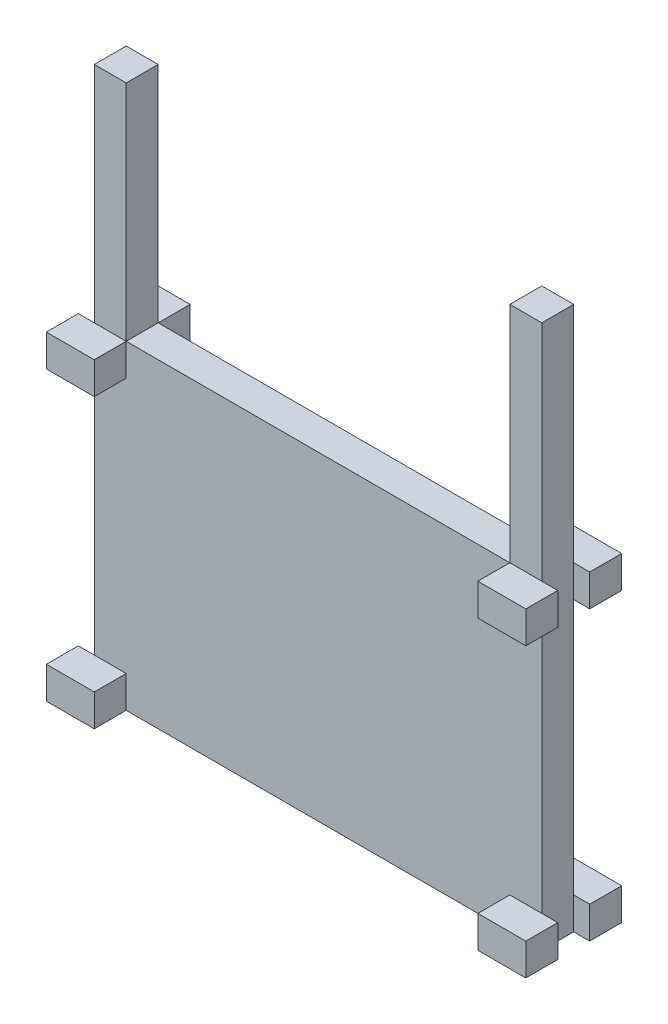
from build123d import *

# Parameters (mm, degrees)
SKETCH1_W           = 35.56
SKETCH1_H           = 25.4
BOSS_EXTRUDE1_DEPTH = 2.54
SKETCH2_W           = 2.54
SKETCH2_H           = 2.54
BOSS_EXTRUDE2_DEPTH = 2.54
SKETCH4_W           = 2.54
SKETCH4_H           = 2.54
BOSS_EXTRUDE4_DEPTH = 1.27
SKETCH5_W           = 2.54
SKETCH5_H           = 2.54
BOSS_EXTRUDE5_DEPTH = 17.78


with BuildPart() as part:
    # Sketch1 → Boss-Extrude1 (new body)
    with BuildSketch(Plane.XY):
        with Locations((-17.78, 12.7)):
            Rectangle(SKETCH1_W, SKETCH1_H)
    extrude(amount=BOSS_EXTRUDE1_DEPTH)

    # Sketch2 → Boss-Extrude2 (add)
    with BuildSketch(Plane.XY.offset(2.54)):
        with Locations((-34.29, 24.13)):
            Rectangle(SKETCH2_W, SKETCH2_H)
        with Locations((-1.27, 24.13)):
            Rectangle(SKETCH2_W, SKETCH2_H)
        with Locations((-1.27, 1.27)):
            Rectangle(SKETCH2_W, SKETCH2_H)
        with Locations((-34.29, 1.27)):
            Rectangle(SKETCH2_W, SKETCH2_H)
    boss_extrude2 = extrude(amount=BOSS_EXTRUDE2_DEPTH)

    # Mirror1: Boss-Extrude2 across plane
    add(boss_extrude2.mirror(Plane.XY.offset(1.27)))

    # Sketch4 → Boss-Extrude4 (add)
    with BuildSketch(Plane.ZY.offset(35.56)):
        with Locations((3.81, 24.13)):
            Rectangle(SKETCH4_W, SKETCH4_H)
        with Locations((-1.27, 24.13)):
            Rectangle(SKETCH4_W, SKETCH4_H)
        with Locations((3.81, 1.27)):
            Rectangle(SKETCH4_W, SKETCH4_H)
        with Locations((-1.27, 1.27)):
            Rectangle(SKETCH4_W, SKETCH4_H)
    boss_extrude4 = extrude(amount=BOSS_EXTRUDE4_DEPTH)

    # Mirror2: Boss-Extrude4 across plane
    add(boss_extrude4.mirror(Plane.ZY.offset(17.78)))

    # Sketch5 → Boss-Extrude5 (add)
    with BuildSketch(Plane(origin=(0, 25.4, 0), x_dir=(1, 0, 0), z_dir=(0, 1, 0))):
        with Locations((-34.29, -1.27)):
            Rectangle(SKETCH5_W, SKETCH5_H)
        with Locations((-1.27, -1.27)):
            Rectangle(SKETCH5_W, SKETCH5_H)
    extrude(amount=BOSS_EXTRUDE5_DEPTH)


solid = part.part
